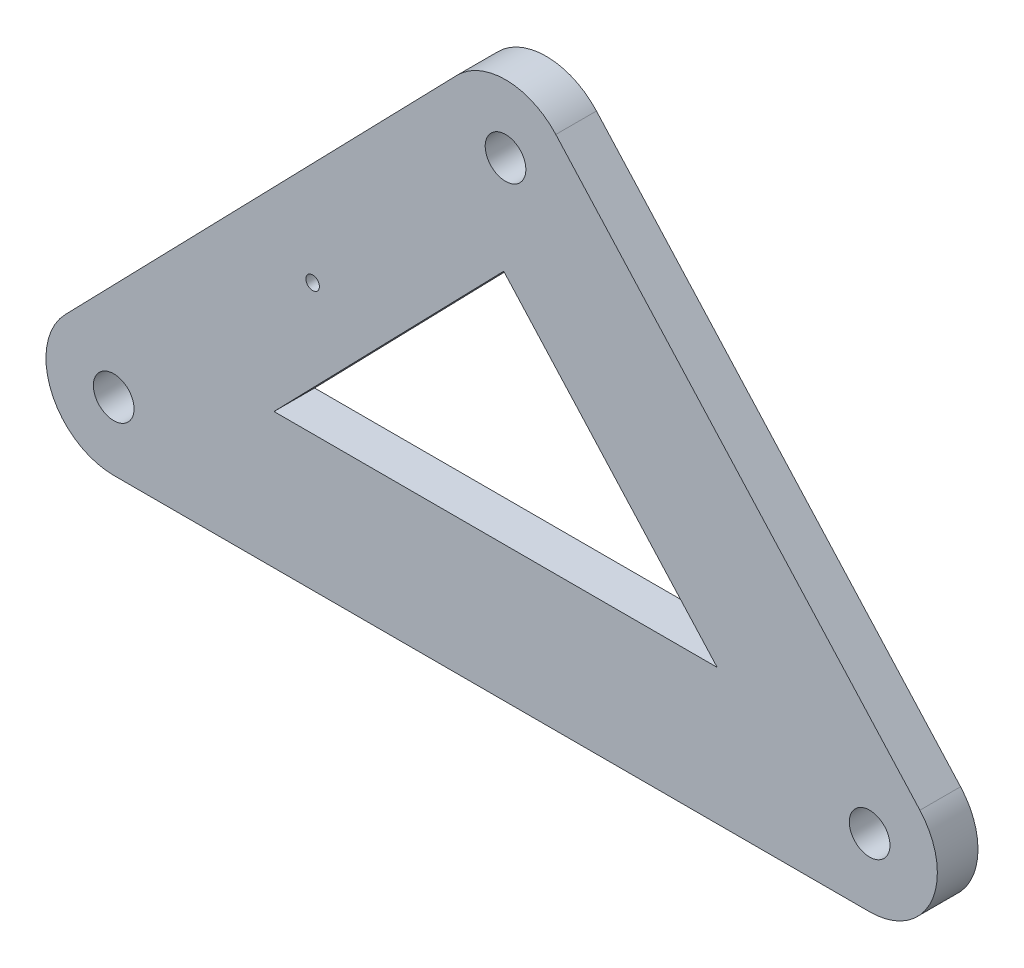
from build123d import *

# Parameters (mm, degrees)
SKETCH1_R           = 1.5
BOSS_EXTRUDE1_DEPTH = 3
SKETCH2_R           = 0.5
CUT_EXTRUDE1_DEPTH  = 71.099319323


with BuildPart() as part:
    # Sketch1 → Boss-Extrude1 (new body)
    with BuildSketch(Plane.XY):
        with BuildLine():
            Line((-3.585571578, 3.484777821), (25.338084336, 33.245021916))
            ThreePointArc((25.338084336, 33.245021916), (29.015202221, 34.759405952), (32.634409542, 33.111409193))
            Line((32.634409542, 33.111409193), (59.510753628, 3.351165098))
            ThreePointArc((59.510753628, 3.351165098), (60.369235466, -2.030292406), (55.8, -5))
            Line((55.8, -5), (0, -5))
            ThreePointArc((0, -5), (-4.605642686, -1.946292745), (-3.585571578, 3.484777821))
        make_face()
        with Locations((28.923655914, 29.760244095)):
            Circle(SKETCH1_R, mode=Mode.SUBTRACT)
        Circle(SKETCH1_R, mode=Mode.SUBTRACT)
        with Locations((55.8, 0)):
            Circle(SKETCH1_R, mode=Mode.SUBTRACT)
        Polygon((11.831834391, 5), (28.7897593, 22.448416138), (44.547346313, 5), align=None, mode=Mode.SUBTRACT)
    extrude(amount=BOSS_EXTRUDE1_DEPTH)

    # Sketch2 → Cut-Extrude1 (cut, through all)
    with BuildSketch(Plane.XY.offset(3)):
        with Locations((14.684404162, 14.660517535)):
            Circle(SKETCH2_R)
    extrude(amount=-CUT_EXTRUDE1_DEPTH, mode=Mode.SUBTRACT)


solid = part.part
